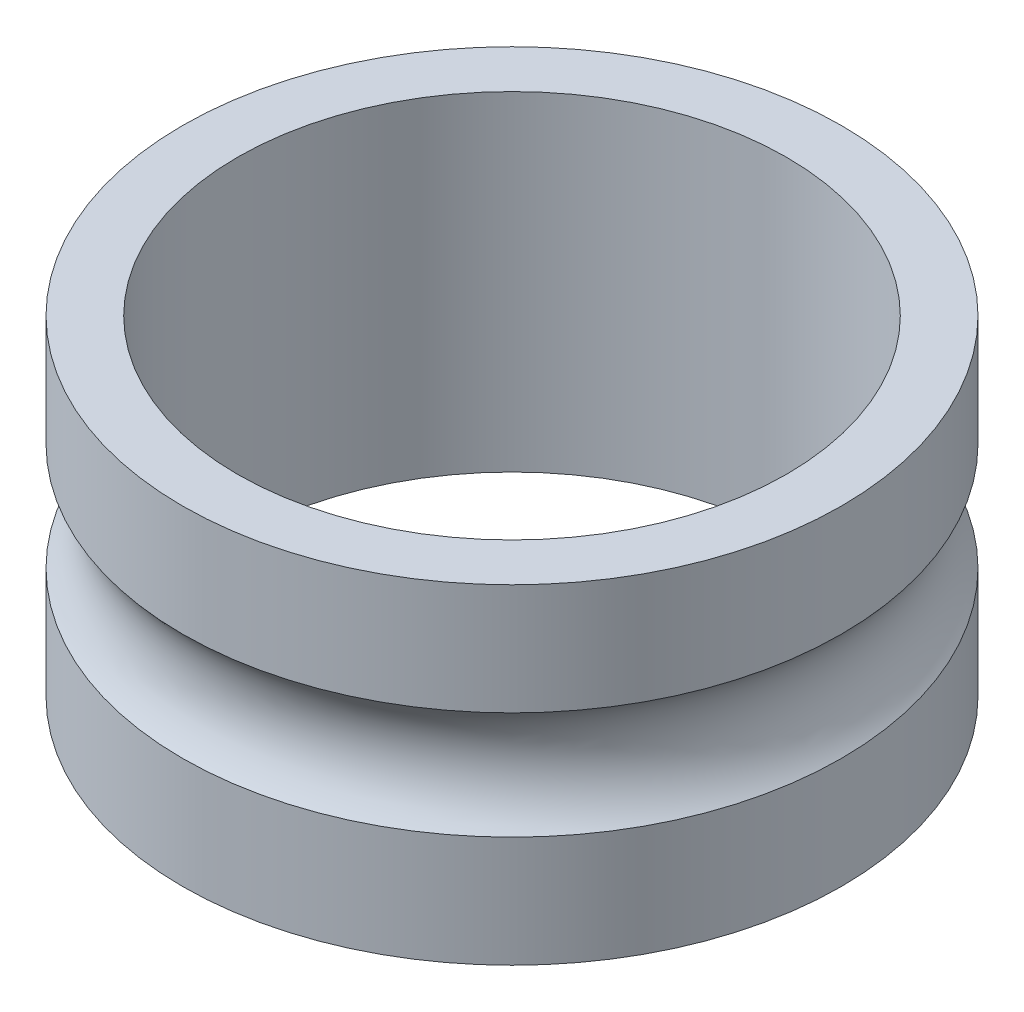
from build123d import *

# Parameters (mm, degrees)
DIAMETER_PROFILE_SKETCH_R     = 3
DIAMETER_PROFILE_SKETCH_R_2   = 2.5
DIAMETER_PROFILE_DEPTH        = 1.5
BEARING_PATH_PROFILE_SKETCH_R = 0.7


with BuildPart() as part:
    # Diameter Profile Sketch → Diameter Profile (new, symmetric)
    with BuildSketch(Plane(origin=(0, 0, 0), x_dir=(1, 0, 0), z_dir=(0, 1, 0))):
        with Locations(Location((0, 0, 0), (0, 0, 270))):
            Circle(DIAMETER_PROFILE_SKETCH_R)
        with Locations(Location((0, 0, 0), (0, 0, 270))):
            Circle(DIAMETER_PROFILE_SKETCH_R_2, mode=Mode.SUBTRACT)
    extrude(amount=DIAMETER_PROFILE_DEPTH, both=True)

    # Bearing Path Profile Sketch → Bearing Path Profile (revolve, cut)
    with BuildSketch(Plane.XY, mode=Mode.PRIVATE) as bearing_path_profile_sk:
        with Locations((3.5, 0)):
            Circle(BEARING_PATH_PROFILE_SKETCH_R)
    revolve(bearing_path_profile_sk.sketch.rotate(Axis((0, 1.5, 0), (0, -1, 0)), 90), axis=Axis((0, 1.5, 0), (0, -1, 0)), mode=Mode.SUBTRACT)


solid = part.part
